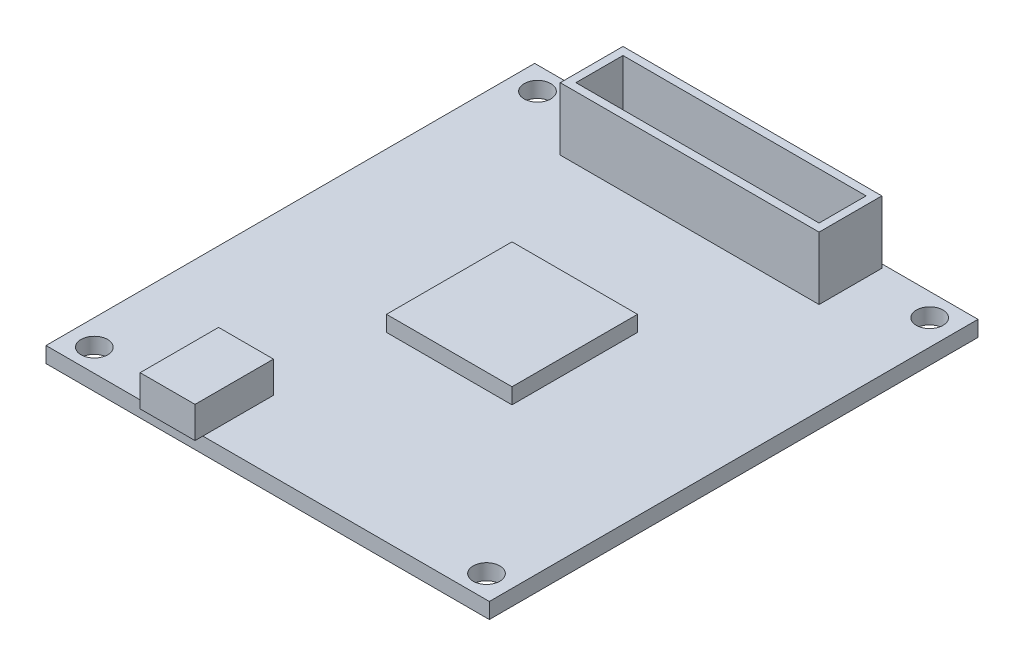
from build123d import *

# Parameters (mm, degrees)
SKETCH_1_W          = 56.52
SKETCH_1_H          = 62.3
SKETCH_1_R          = 1.7
EXTRUDE_1_DEPTH     = 2
SKETCH_2_W          = 16
SKETCH_2_H          = 16
EXTRUDE_2_DEPTH     = 2
SKETCH_3_W          = 33
SKETCH_3_H          = 8
EXTRUDE_3_DEPTH     = 8
SKETCH_4_W          = 31
SKETCH_4_H          = 6
CUT_EXTRUDE_1_DEPTH = 8
SKETCH_5_W          = 7
SKETCH_5_H          = 10
EXTRUDE_4_DEPTH     = 4


with BuildPart() as part:
    # 草图1 → 凸台-拉伸1 (new body)
    with BuildSketch(Plane(origin=(0, 0, 0), x_dir=(1, 0, 0), z_dir=(0, 1, 0))):
        Rectangle(SKETCH_1_W, SKETCH_1_H)
        with Locations(Location((25, 28.25, 0), (0, 0, 270))):
            Circle(SKETCH_1_R, mode=Mode.SUBTRACT)
        with Locations(Location((25, -28.25, 0), (0, 0, 90))):
            Circle(SKETCH_1_R, mode=Mode.SUBTRACT)
        with Locations(Location((-25, -28.25, 0), (0, 0, 270))):
            Circle(SKETCH_1_R, mode=Mode.SUBTRACT)
        with Locations(Location((-25, 28.25, 0), (0, 0, 90))):
            Circle(SKETCH_1_R, mode=Mode.SUBTRACT)
    extrude(amount=EXTRUDE_1_DEPTH)

    # 草图2 → 凸台-拉伸2 (add)
    with BuildSketch(Plane(origin=(0, 2, 0), x_dir=(1, 0, 0), z_dir=(0, 1, 0))):
        Rectangle(SKETCH_2_W, SKETCH_2_H)
    extrude(amount=EXTRUDE_2_DEPTH)

    # 草图3 → 凸台-拉伸3 (add)
    with BuildSketch(Plane(origin=(0, 2, 0), x_dir=(1, 0, 0), z_dir=(0, 1, 0))):
        with Locations((0, 26.65)):
            Rectangle(SKETCH_3_W, SKETCH_3_H)
    extrude(amount=EXTRUDE_3_DEPTH)

    # 草图4 → 切除-拉伸1 (cut)
    with BuildSketch(Plane(origin=(0, 10, 0), x_dir=(1, 0, 0), z_dir=(0, 1, 0))):
        with Locations((0, 26.65)):
            Rectangle(SKETCH_4_W, SKETCH_4_H)
    extrude(amount=-CUT_EXTRUDE_1_DEPTH, mode=Mode.SUBTRACT)

    # 草图5 → 凸台-拉伸4 (add)
    with BuildSketch(Plane(origin=(0, 2, 0), x_dir=(1, 0, 0), z_dir=(0, 1, 0))):
        with Locations((-11.76, -27.15)):
            Rectangle(SKETCH_5_W, SKETCH_5_H)
    extrude(amount=EXTRUDE_4_DEPTH)


solid = part.part
